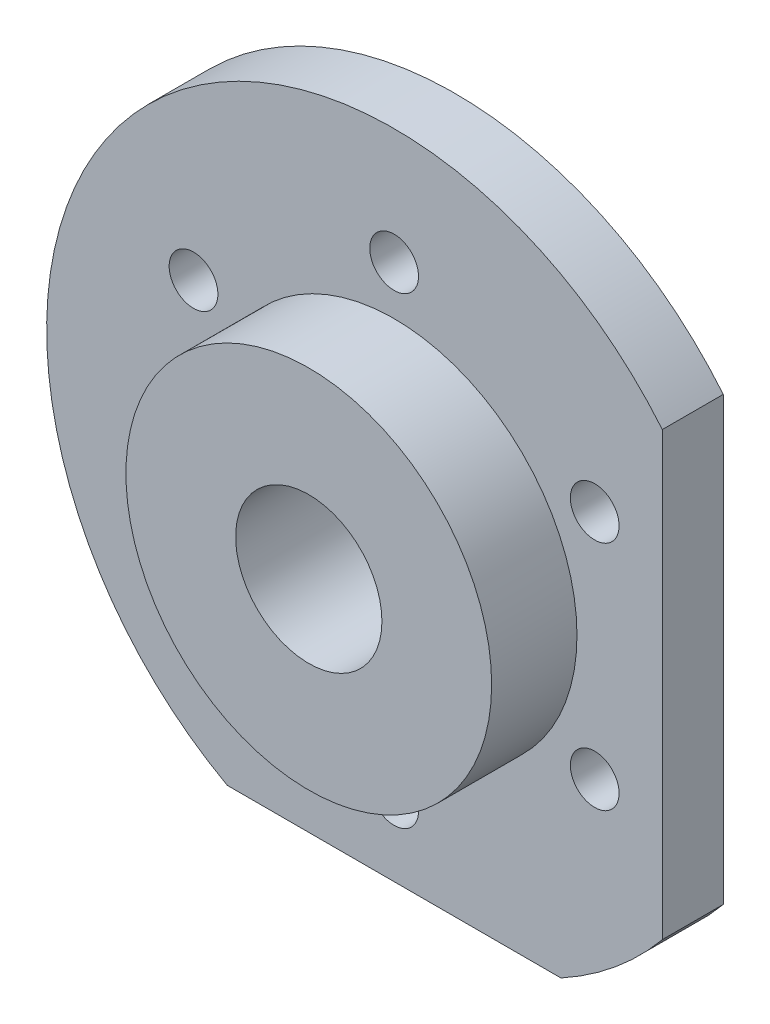
from build123d import *

# Parameters (mm, degrees)
SKETCH1_R           = 15
SKETCH1_R_2         = 4
BOSS_EXTRUDE1_DEPTH = 1
SKETCH1_4_R         = 2
SKETCH1_4_R_2       = 15
BOSS_EXTRUDE2_DEPTH = 5
BOSS_EXTRUDE3_START = 12
SKETCH1_6_R         = 15
SKETCH1_6_R_2       = 6
BOSS_EXTRUDE3_DEPTH = 12
BOSS_EXTRUDE4_START = 2
SKETCH1_7_R         = 6
SKETCH1_7_R_2       = 4
BOSS_EXTRUDE4_DEPTH = 2


with BuildPart() as part:
    # Sketch1 → Boss-Extrude1 (new body)
    with BuildSketch(Plane.XY):
        Circle(SKETCH1_R)
        Circle(SKETCH1_R_2, mode=Mode.SUBTRACT)
    extrude(amount=-BOSS_EXTRUDE1_DEPTH)


with BuildPart() as body_2:
    # Sketch1<4> → Boss-Extrude2 (new body)
    with BuildSketch(Plane.XY):
        with BuildLine():
            Line((22, -18.117670932), (22, 18.117670932))
            ThreePointArc((22, 18.117670932), (-21.956152501, 18.170783345), (-13.683932183, -25))
            Line((-13.683932183, -25), (13.683932183, -25))
            ThreePointArc((13.683932183, -25), (18.170783345, -21.956152501), (22, -18.117670932))
        make_face()
        with Locations((-16.454482672, -9.5)):
            Circle(SKETCH1_4_R, mode=Mode.SUBTRACT)
        with Locations((0, -19)):
            Circle(SKETCH1_4_R, mode=Mode.SUBTRACT)
        Circle(SKETCH1_4_R_2, mode=Mode.SUBTRACT)
        with Locations((16.454482672, -9.5)):
            Circle(SKETCH1_4_R, mode=Mode.SUBTRACT)
        with Locations((-16.454482672, 9.5)):
            Circle(SKETCH1_4_R, mode=Mode.SUBTRACT)
        with Locations((16.454482672, 9.5)):
            Circle(SKETCH1_4_R, mode=Mode.SUBTRACT)
        with Locations((0, 19)):
            Circle(SKETCH1_4_R, mode=Mode.SUBTRACT)
    extrude(amount=BOSS_EXTRUDE2_DEPTH)

    # Sketch1<6> → Boss-Extrude3 (add)
    with BuildSketch(Plane.XY.offset(BOSS_EXTRUDE3_START)):
        Circle(SKETCH1_6_R)
        Circle(SKETCH1_6_R_2, mode=Mode.SUBTRACT)
    extrude(amount=-BOSS_EXTRUDE3_DEPTH)

    # Sketch1<7> → Boss-Extrude4 (add)
    with BuildSketch(Plane.XY.offset(BOSS_EXTRUDE4_START)):
        Circle(SKETCH1_7_R)
        Circle(SKETCH1_7_R_2, mode=Mode.SUBTRACT)
    extrude(amount=-BOSS_EXTRUDE4_DEPTH)


solid = Compound([part.part, body_2.part])
